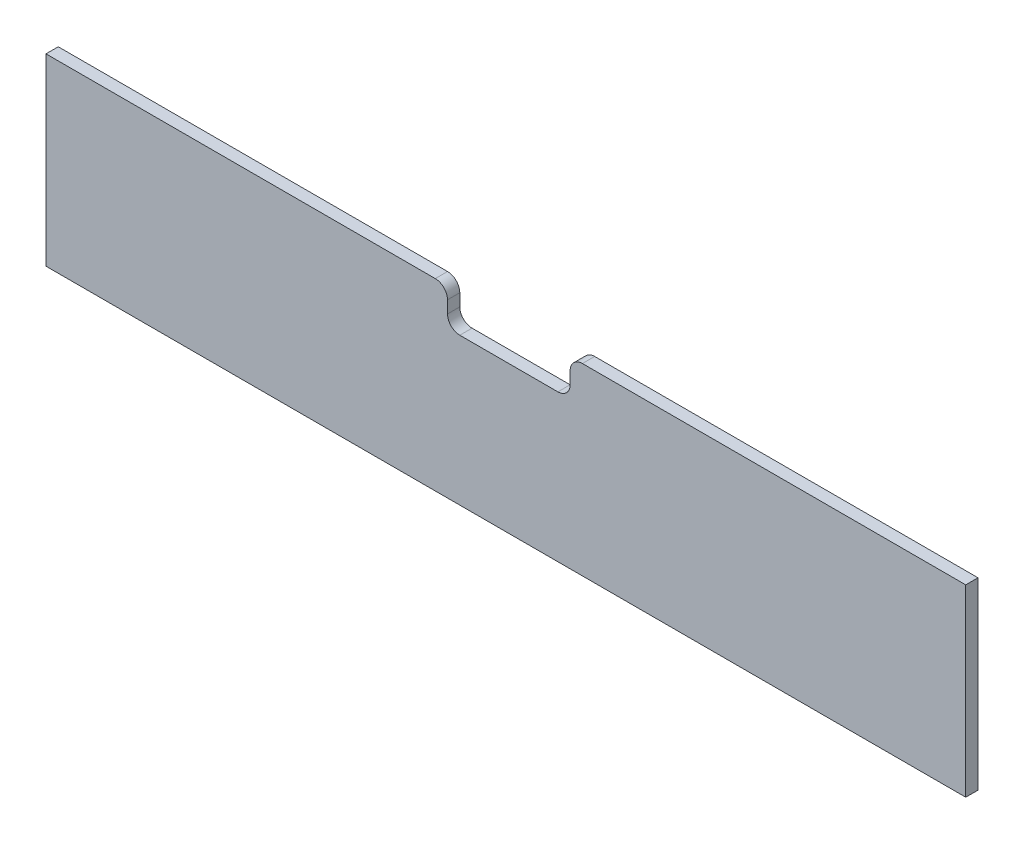
from build123d import *

# Parameters (mm, degrees)
SKETCH1_W           = 952.5
SKETCH1_H           = 190.5
BOSS_EXTRUDE1_DEPTH = 12.7
SKETCH5_W           = 127
SKETCH5_H           = 38.1
CUT_EXTRUDE3_DEPTH  = 486.84762529
FILLET1_R           = 12.7
SKETCH6_R           = 3.175
CUT_EXTRUDE4_DEPTH  = 11.43
SKETCH7_R           = 2.5
CUT_EXTRUDE5_DEPTH  = 8
SKETCH8_R           = 2.5
CUT_EXTRUDE6_DEPTH  = 8
SKETCH9_R           = 3.175
CUT_EXTRUDE7_DEPTH  = 11.43


with BuildPart() as part:
    # Sketch1 → Boss-Extrude1 (new body)
    with BuildSketch(Plane.XY):
        Rectangle(SKETCH1_W, SKETCH1_H)
    extrude(amount=BOSS_EXTRUDE1_DEPTH)

    # Sketch5 → Cut-Extrude3 (cut, through all)
    with BuildSketch(Plane.XY.offset(12.7)):
        with Locations((3.078763255, 76.2)):
            Rectangle(SKETCH5_W, SKETCH5_H)
    extrude(amount=-CUT_EXTRUDE3_DEPTH, mode=Mode.SUBTRACT)

    # Fillet1
    fillet1_edges = [part.edges().sort_by_distance(p)[0] for p in [
        (66.578763255, 95.25, 6.35),
        (66.578763255, 57.15, 6.35),
        (-60.421236745, 57.15, 6.35),
        (-60.421236745, 95.25, 6.35),
    ]]
    fillet(fillet1_edges, radius=FILLET1_R)

    # Sketch6 → Cut-Extrude4 (cut)
    with BuildSketch(Plane(origin=(0, 0, 0), x_dir=(-1, 0, 0), z_dir=(0, 0, -1))):
        with Locations((-425.45, 0)):
            Circle(SKETCH6_R)
        with Locations(Location((425.45, 0, 0), (0, 0, 180))):
            Circle(SKETCH6_R)
    extrude(amount=-CUT_EXTRUDE4_DEPTH, mode=Mode.SUBTRACT)

    # Sketch7 → Cut-Extrude5 (cut)
    with BuildSketch(Plane(origin=(0, 0, 0), x_dir=(-1, 0, 0), z_dir=(0, 0, -1))):
        with Locations((-425.45, 44.45)):
            Circle(SKETCH7_R)
        with Locations(Location((-425.45, -44.45, 0), (0, 0, 180))):
            Circle(SKETCH7_R)
        with Locations((425.45, -44.45)):
            Circle(SKETCH7_R)
        with Locations(Location((425.45, 44.45, 0), (0, 0, 180))):
            Circle(SKETCH7_R)
    extrude(amount=-CUT_EXTRUDE5_DEPTH, mode=Mode.SUBTRACT)

    # Sketch8 → Cut-Extrude6 (cut)
    with BuildSketch(Plane(origin=(0, 0, 0), x_dir=(-1, 0, 0), z_dir=(0, 0, -1))):
        with Locations((-425.45, -82.55)):
            Circle(SKETCH8_R)
        with Locations((-212.725, -82.55)):
            Circle(SKETCH8_R)
        with Locations((0, -82.55)):
            Circle(SKETCH8_R)
        with Locations((212.725, -82.55)):
            Circle(SKETCH8_R)
        with Locations((425.45, -82.55)):
            Circle(SKETCH8_R)
    extrude(amount=-CUT_EXTRUDE6_DEPTH, mode=Mode.SUBTRACT)

    # Sketch9 → Cut-Extrude7 (cut)
    with BuildSketch(Plane(origin=(0, 0, 0), x_dir=(-1, 0, 0), z_dir=(0, 0, -1))):
        with Locations((-319.0875, -82.55)):
            Circle(SKETCH9_R)
        with Locations((-106.3625, -82.55)):
            Circle(SKETCH9_R)
        with Locations((106.3625, -82.55)):
            Circle(SKETCH9_R)
        with Locations((319.0875, -82.55)):
            Circle(SKETCH9_R)
    extrude(amount=-CUT_EXTRUDE7_DEPTH, mode=Mode.SUBTRACT)


solid = part.part
